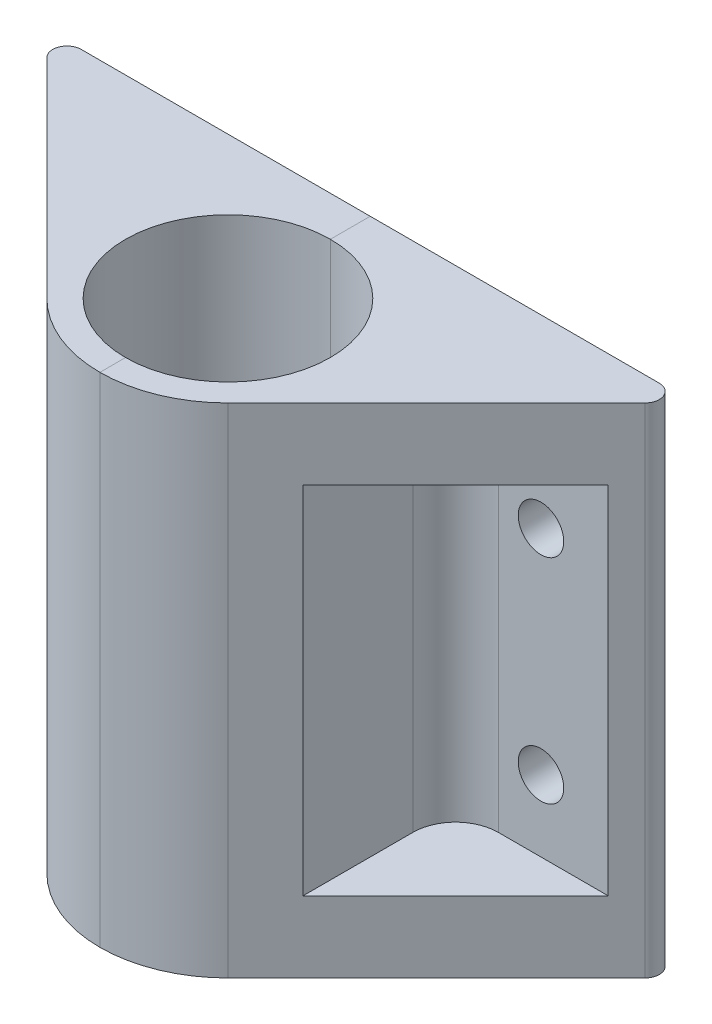
from build123d import *

# Parameters (mm, degrees)
SKETCH_1_R          = 9
EXTRUDE_1_DEPTH     = 35
SKETCH_2_R          = 7.2
CUT_EXTRUDE_1_DEPTH = 30
SKETCH_3_R          = 7.2
EXTRUDE_2_DEPTH     = 35
SKETCH_4_W          = 13.727922061
SKETCH_4_H          = 25
CUT_EXTRUDE_2_DEPTH = 16
FILLET_1_R          = 3
SKETCH_5_R          = 1.6
CUT_EXTRUDE_3_DEPTH = 45.694053757
FILLET_4_R          = 1


with BuildPart() as part:
    # 草图1 → 凸台-拉伸1 (new body)
    with BuildSketch(Plane(origin=(0, 0, 0), x_dir=(1, 0, 0), z_dir=(0, 1, 0))):
        with Locations(Location((0, 0, 0), (0, 0, 270))):
            Circle(SKETCH_1_R)
    extrude(amount=EXTRUDE_1_DEPTH)

    # 草图2 → 切除-拉伸1 (cut)
    with BuildSketch(Plane(origin=(0, 35, 0), x_dir=(1, 0, 0), z_dir=(0, 1, 0))):
        with Locations(Location((0, 0, 0), (0, 0, 270))):
            Circle(SKETCH_2_R)
    extrude(amount=-CUT_EXTRUDE_1_DEPTH, mode=Mode.SUBTRACT)

    # 草图3 → 凸台-拉伸2 (add)
    with BuildSketch(Plane.XZ):
        with BuildLine():
            Line((-6.363961031, 6.363961031), (-22.727922061, -10))
            Line((-22.727922061, -10), (22.727922061, -10))
            Line((22.727922061, -10), (6.363961031, 6.363961031))
            ThreePointArc((6.363961031, 6.363961031), (0, 9), (-6.363961031, 6.363961031))
        make_face()
        with Locations(Location((0, 0, 0), (0, 0, 90))):
            Circle(SKETCH_3_R, mode=Mode.SUBTRACT)
    extrude(amount=-EXTRUDE_2_DEPTH)

    # 草图4 → 切除-拉伸2 (cut)
    with BuildSketch(Plane.XY.offset(9)):
        with Locations((15.863961031, 17.5)):
            Rectangle(SKETCH_4_W, SKETCH_4_H)
        with Locations((-15.863961031, 17.5)):
            Rectangle(SKETCH_4_W, SKETCH_4_H)
    extrude(amount=-CUT_EXTRUDE_2_DEPTH, mode=Mode.SUBTRACT)

    # 圆角1
    fillet_1_edges = [part.edges().sort_by_distance(p)[0] for p in [
        (9, 17.5, -7),
        (-9, 17.5, -7),
    ]]
    fillet(fillet_1_edges, radius=FILLET_1_R)

    # 草图5 → 切除-拉伸3 (cut, through all)
    with BuildSketch(Plane.XY.offset(-7)):
        with Locations((-15, 25)):
            Circle(SKETCH_5_R)
        with Locations((-15, 10)):
            Circle(SKETCH_5_R)
        with Locations((15, 10)):
            Circle(SKETCH_5_R)
        with Locations((15, 25)):
            Circle(SKETCH_5_R)
    extrude(amount=-CUT_EXTRUDE_3_DEPTH, mode=Mode.SUBTRACT)

    # 圆角4
    fillet_4_edges = [part.edges().sort_by_distance(p)[0] for p in [
        (22.727922061, 17.5, -10),
        (-22.727922061, 17.5, -10),
    ]]
    fillet(fillet_4_edges, radius=FILLET_4_R)


with BuildPart() as body_2:
    # Split Bodies 1: the piece on the far side of the plane
    add(part.part)
    split(bisect_by=Plane(origin=(0, 0, 0), x_dir=(0, 0, 1), z_dir=(1, 0, 0)), keep=Keep.BOTTOM)


with BuildPart() as part_1:
    add(part.part)

    # Split Bodies 1
    split(bisect_by=Plane(origin=(0, 0, 0), x_dir=(0, 0, 1), z_dir=(1, 0, 0)), keep=Keep.TOP)


solid = Compound([body_2.part, part_1.part])
